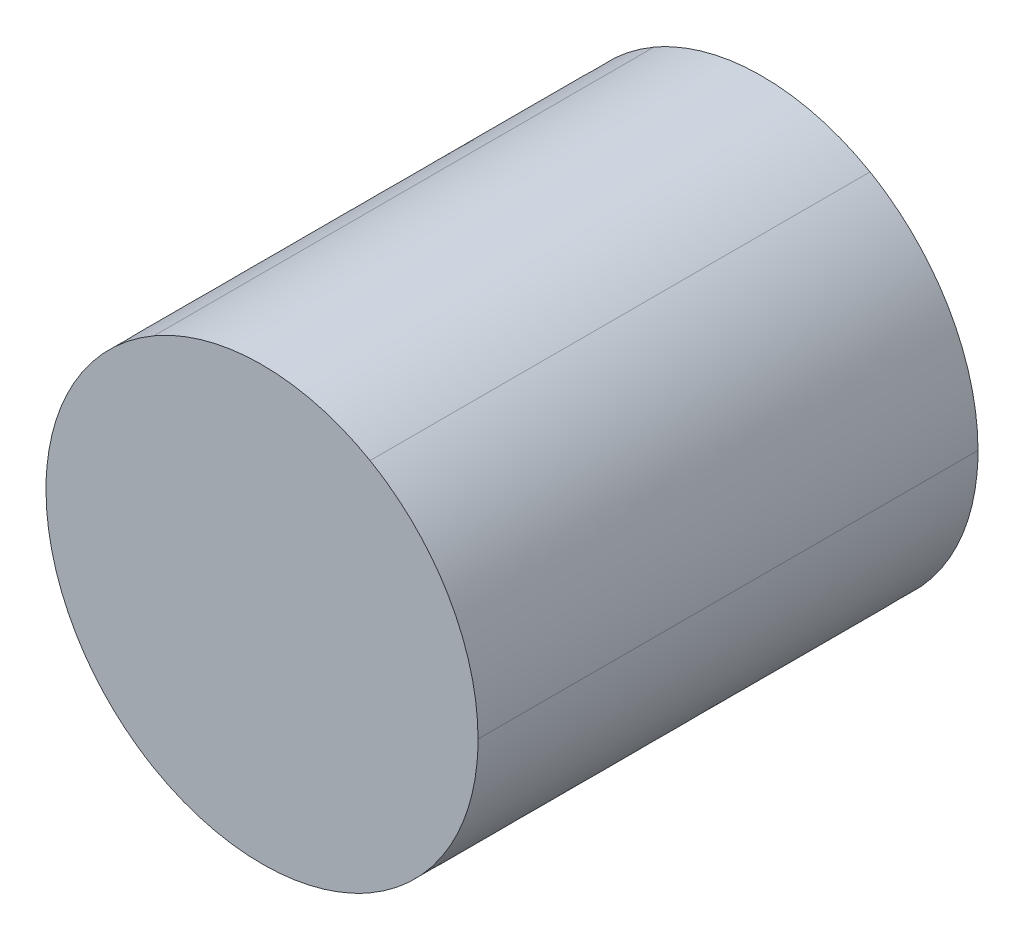
from build123d import *

# Parameters (mm, degrees)
BOSS_EXTRUDE7_DEPTH = 6.35


with BuildPart() as part:
    # planet pin → Boss-Extrude7 (new body)
    with BuildSketch(Plane.XY):
        with BuildLine():
            add(Edge.make_bspline(
                [(74.166418299, 167.967747425), (74.167078299, 166.987078425), (73.644276299, 166.080620425), (72.795101299, 165.590095425)],
                knots=[0, 0, 0, 0, 1, 1, 1, 1], degree=3))
            add(Edge.make_bspline(
                [(72.795101299, 165.590095425), (71.945927299, 165.099569425), (70.899510299, 165.099569425), (70.050335299, 165.590095425)],
                knots=[0, 0, 0, 0, 1, 1, 1, 1], degree=3))
            add(Edge.make_bspline(
                [(70.050335299, 165.590095425), (69.201161299, 166.080620425), (68.678359299, 166.987078425), (68.679019299, 167.967747425)],
                knots=[0, 0, 0, 0, 1, 1, 1, 1], degree=3))
            add(Edge.make_bspline(
                [(68.679019299, 167.967747425), (68.678359299, 168.948416425), (69.201161299, 169.854874425), (70.050335299, 170.345399425)],
                knots=[0, 0, 0, 0, 1, 1, 1, 1], degree=3))
            add(Edge.make_bspline(
                [(70.050335299, 170.345399425), (70.899510299, 170.835924425), (71.945927299, 170.835924425), (72.795101299, 170.345399425)],
                knots=[0, 0, 0, 0, 1, 1, 1, 1], degree=3))
            add(Edge.make_bspline(
                [(72.795101299, 170.345399425), (73.644276299, 169.854874425), (74.167078299, 168.948416425), (74.166418299, 167.967747425)],
                knots=[0, 0, 0, 0, 1, 1, 1, 1], degree=3))
        make_face()
    extrude(amount=BOSS_EXTRUDE7_DEPTH)


solid = part.part
